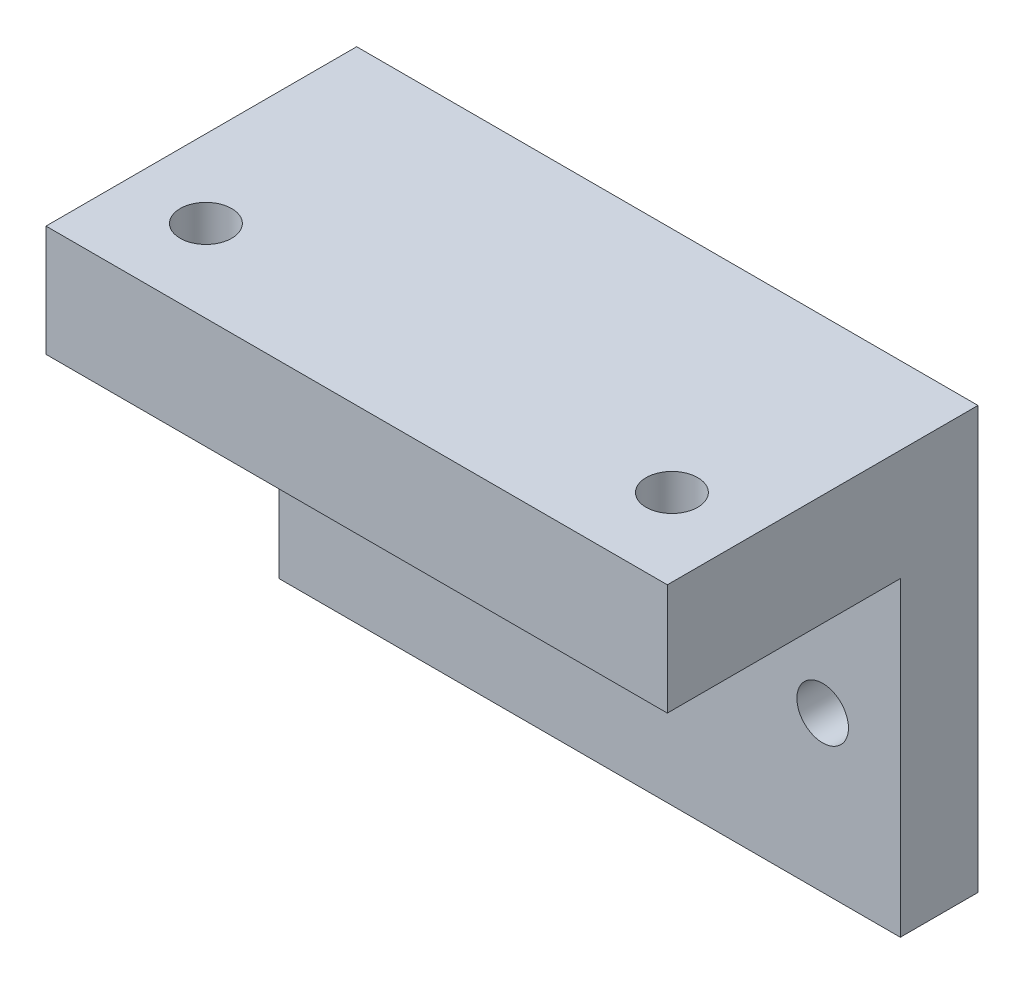
from build123d import *

# Parameters (mm, degrees)
SKETCH_1_W          = 80
SKETCH_1_H          = 40
EXTRUDE_1_DEPTH     = 10
SKETCH_4_R          = 3.32
CUT_EXTRUDE_3_DEPTH = 46.82575695
SKETCH_2_W          = 80
SKETCH_2_H          = 14.306395687
EXTRUDE_3_DEPTH     = 40
SKETCH_5_R          = 3.32
CUT_EXTRUDE_4_DEPTH = 40


with BuildPart() as part:
    # 草图1 → 凸台-拉伸1 (new body)
    with BuildSketch(Plane.XY):
        Rectangle(SKETCH_1_W, SKETCH_1_H)
    extrude(amount=EXTRUDE_1_DEPTH)

    # 草图4 → 切除-拉伸3 (cut, through all)
    with BuildSketch(Plane.XY.offset(10)):
        with Locations((30, 0)):
            Circle(SKETCH_4_R)
        with Locations((-30, 0)):
            Circle(SKETCH_4_R)
    extrude(amount=-CUT_EXTRUDE_3_DEPTH, mode=Mode.SUBTRACT)

    # 草图2 → 凸台-拉伸3 (add)
    with BuildSketch(Plane(origin=(0, 0, 0), x_dir=(-1, 0, 0), z_dir=(0, 0, -1))):
        with Locations((0, 27.153197844)):
            Rectangle(SKETCH_2_W, SKETCH_2_H)
    extrude(amount=-EXTRUDE_3_DEPTH)

    # 草图5 → 切除-拉伸4 (cut)
    with BuildSketch(Plane.XZ.offset(-20)):
        with Locations(Location((30, 29.40906451, 0), (0, 0, 270))):
            Circle(SKETCH_5_R)
        with Locations(Location((-30, 29.40906451, 0), (0, 0, 270))):
            Circle(SKETCH_5_R)
    extrude(amount=-CUT_EXTRUDE_4_DEPTH, mode=Mode.SUBTRACT)


solid = part.part
